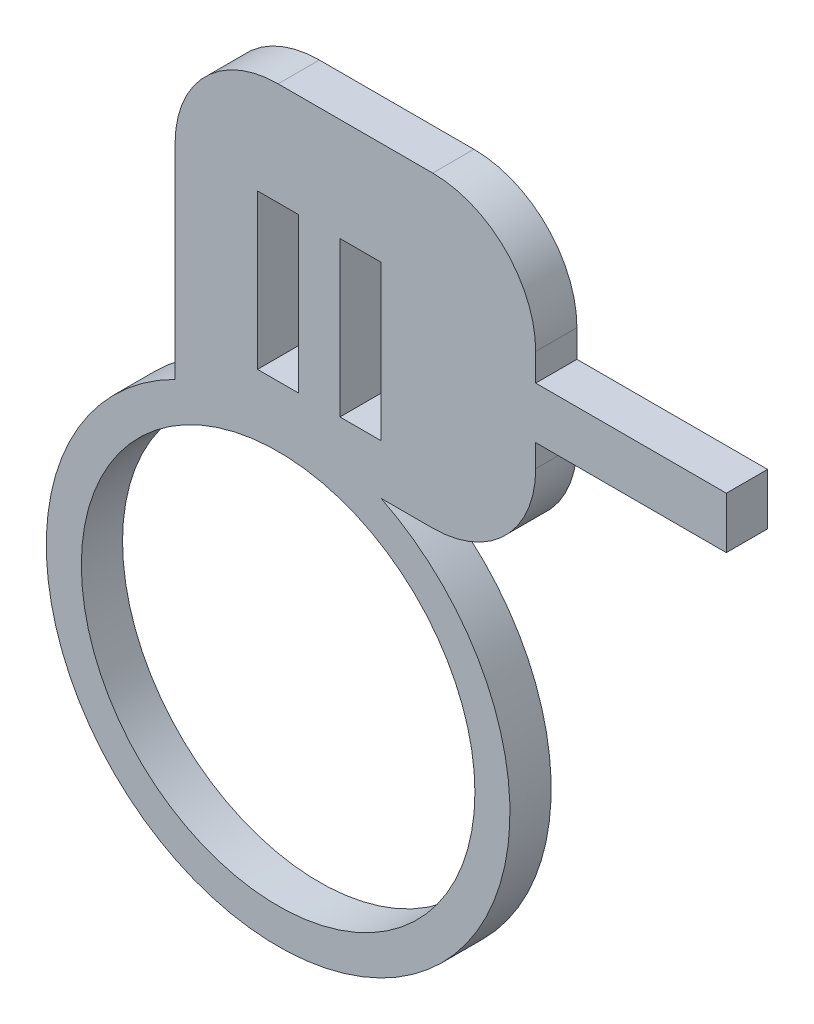
from build123d import *

# Parameters (mm, degrees)
SKETCH1_R           = 28.575
BOSS_EXTRUDE1_DEPTH = 5.08
SKETCH2_W           = 25.4
SKETCH2_H           = 5.08
BOSS_EXTRUDE2_DEPTH = 63.5
SKETCH3_R           = 24.257
CUT_EXTRUDE1_DEPTH  = 50.8
SKETCH4_W           = 5.08
SKETCH4_H           = 19.05
CUT_EXTRUDE2_DEPTH  = 50.8
SKETCH6_W           = 5.08
SKETCH6_H           = 37.902331649
BOSS_EXTRUDE4_DEPTH = 19.05
SKETCH7_W           = 5.08
SKETCH7_H           = 19.05
CUT_EXTRUDE3_DEPTH  = 25.4
FILLET1_R           = 12.7
SKETCH8_W           = 5.08
SKETCH8_H           = 6.35
BOSS_EXTRUDE5_DEPTH = 23.495


with BuildPart() as part:
    # Sketch1 → Boss-Extrude1 (new body)
    with BuildSketch(Plane.XY):
        Circle(SKETCH1_R)
    extrude(amount=BOSS_EXTRUDE1_DEPTH)

    # Sketch2 → Boss-Extrude2 (add)
    with BuildSketch(Plane(origin=(0, 0, 0), x_dir=(1, 0, 0), z_dir=(0, 1, 0))):
        with Locations((0, -2.54)):
            Rectangle(SKETCH2_W, SKETCH2_H)
    extrude(amount=BOSS_EXTRUDE2_DEPTH)

    # Sketch3 → Cut-Extrude1 (cut)
    with BuildSketch(Plane(origin=(0, 0, 0), x_dir=(-1, 0, 0), z_dir=(0, 0, -1))):
        Circle(SKETCH3_R)
    extrude(amount=-CUT_EXTRUDE1_DEPTH, mode=Mode.SUBTRACT)

    # Sketch4 → Cut-Extrude2 (cut)
    with BuildSketch(Plane(origin=(0, 0, 0), x_dir=(-1, 0, 0), z_dir=(0, 0, -1))):
        with Locations((0, 41.275)):
            Rectangle(SKETCH4_W, SKETCH4_H)
    extrude(amount=-CUT_EXTRUDE2_DEPTH, mode=Mode.SUBTRACT)

    # Sketch6 → Boss-Extrude4 (add)
    with BuildSketch(Plane(origin=(12.7, 0, 0), x_dir=(0, 0, -1), z_dir=(1, 0, 0))):
        with Locations((-2.54, 44.548834176)):
            Rectangle(SKETCH6_W, SKETCH6_H)
    extrude(amount=BOSS_EXTRUDE4_DEPTH)

    # Sketch7 → Cut-Extrude3 (cut)
    with BuildSketch(Plane.XY.offset(5.08)):
        with Locations((10.16, 41.275)):
            Rectangle(SKETCH7_W, SKETCH7_H)
    extrude(amount=-CUT_EXTRUDE3_DEPTH, mode=Mode.SUBTRACT)

    # Fillet1
    fillet1_edges = [part.edges().sort_by_distance(p)[0] for p in [
        (-12.7, 63.5, 2.54),
        (31.75, 63.5, 2.54),
        (31.75, 25.597668351, 2.54),
    ]]
    fillet(fillet1_edges, radius=FILLET1_R)

    # Sketch8 → Boss-Extrude5 (add)
    with BuildSketch(Plane(origin=(31.75, 0, 0), x_dir=(0, 0, -1), z_dir=(1, 0, 0))):
        with Locations((-2.54, 44.2518817)):
            Rectangle(SKETCH8_W, SKETCH8_H)
    extrude(amount=BOSS_EXTRUDE5_DEPTH)


solid = part.part
